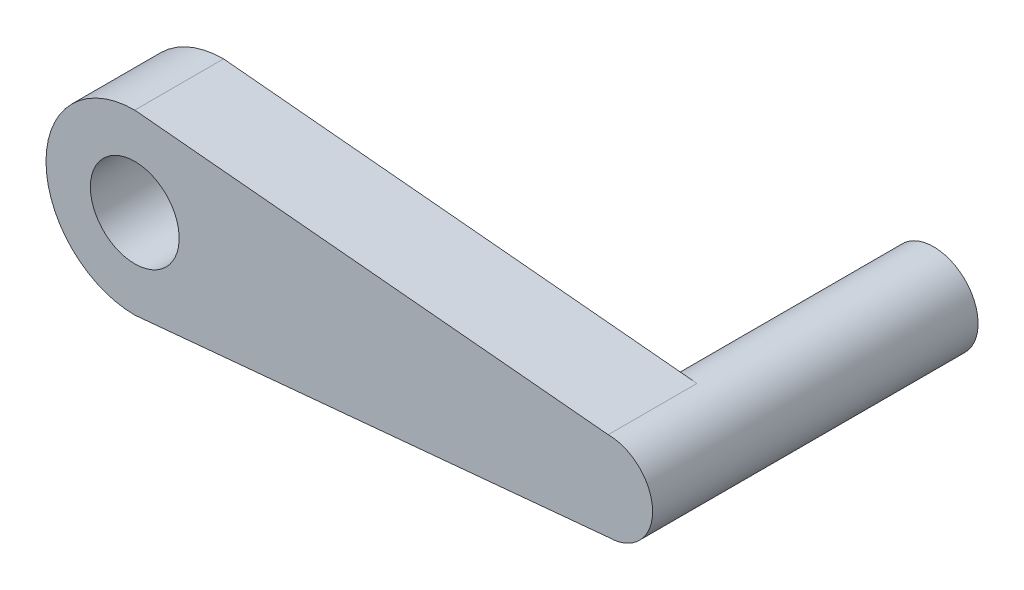
from build123d import *

# Parameters (mm, degrees)
SKETCH1_R           = 4.7625
BOSS_EXTRUDE1_DEPTH = 9.525
BOSS_EXTRUDE4_START = 25.4
SKETCH4_R           = 4.7625
BOSS_EXTRUDE4_DEPTH = 25.4


with BuildPart() as part:
    # Sketch1 → Boss-Extrude1 (new body)
    with BuildSketch(Plane.XY):
        with BuildLine():
            ThreePointArc((0, 9.525), (-9.525, 0), (0, -9.525))
            Line((0, -9.525), (1.770377541, -9.359027106))
            Line((1.770377541, -9.359027106), (50.8, -4.7625))
            ThreePointArc((50.8, -4.7625), (55.5625, 0), (50.8, 4.7625))
            Line((50.8, 4.7625), (1.770377541, 9.359027106))
            Line((1.770377541, 9.359027106), (0, 9.525))
        make_face()
        with Locations(Location((0, 0, 0), (0, 0, 180))):
            Circle(SKETCH1_R, mode=Mode.SUBTRACT)
    extrude(amount=BOSS_EXTRUDE1_DEPTH)

    # Sketch4 → Boss-Extrude4 (add)
    with BuildSketch(Plane(origin=(0, 0, 0), x_dir=(-1, 0, 0), z_dir=(0, 0, -1)).offset(BOSS_EXTRUDE4_START)):
        with Locations((-50.8, 0)):
            Circle(SKETCH4_R)
    extrude(amount=-BOSS_EXTRUDE4_DEPTH)


solid = part.part
